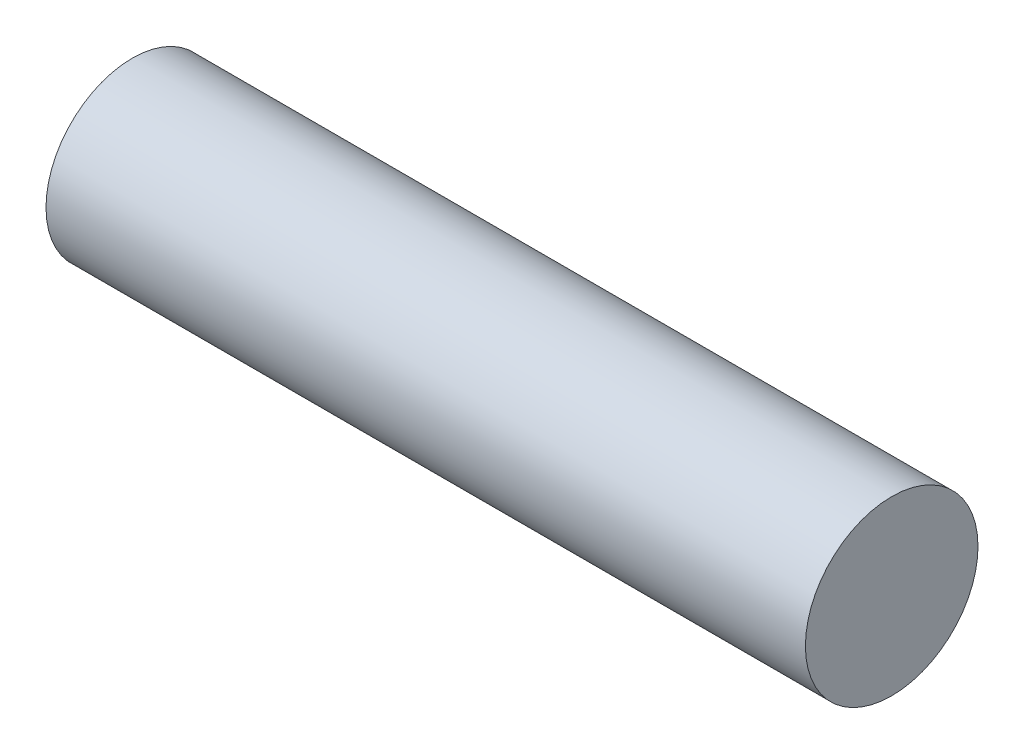
from build123d import *

# Parameters (mm, degrees)
SKETCH_1_R      = 5
EXTRUDE_1_DEPTH = 44


with BuildPart() as part:
    # Эскиз1 → Бобышка-Вытянуть1 (new body)
    with BuildSketch(Plane(origin=(0, 0, 0), x_dir=(0, 0, -1), z_dir=(1, 0, 0))):
        Circle(SKETCH_1_R)
    extrude(amount=EXTRUDE_1_DEPTH)


solid = part.part
